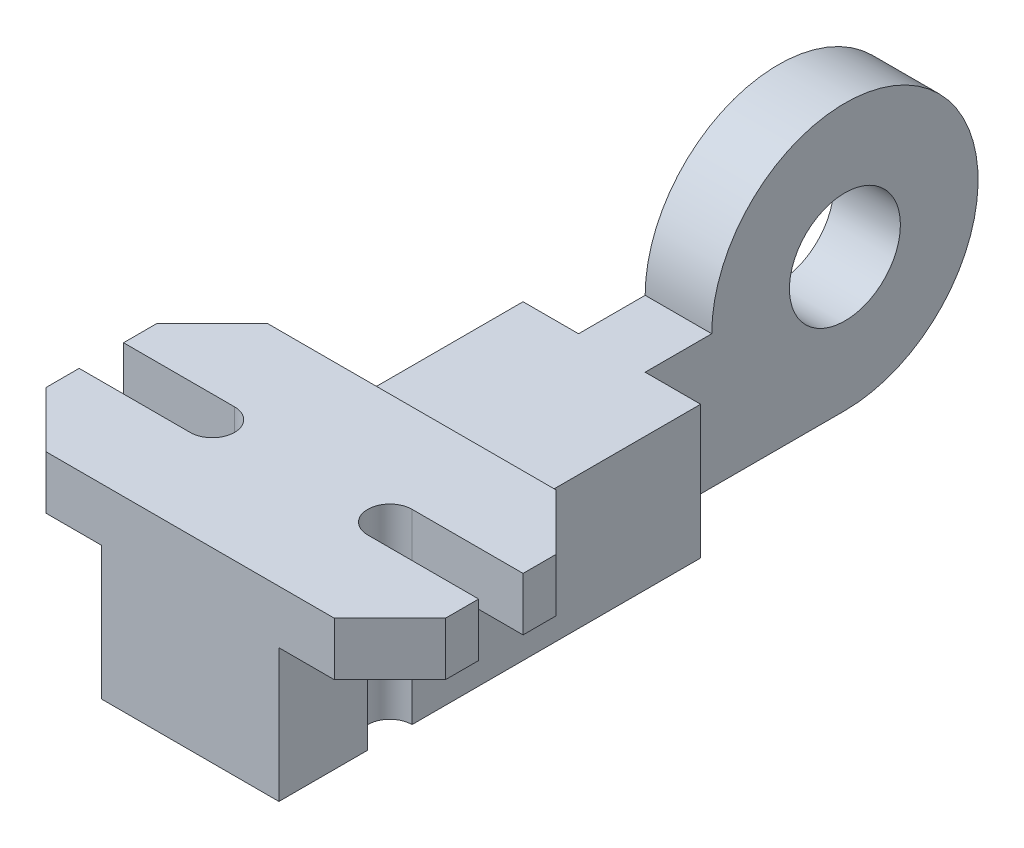
from build123d import *

# Parameters (mm, degrees)
SKETCH1_W           = 95
SKETCH1_H           = 30
BOSS_EXTRUDE1_DEPTH = 40
BOSS_EXTRUDE2_DEPTH = 12
SKETCH4_R           = 5
CUT_EXTRUDE1_DEPTH  = 87.62461911
SKETCH6_R           = 12.5
BOSS_EXTRUDE3_DEPTH = 7.5


with BuildPart() as part:
    # Sketch1 → Boss-Extrude1 (new body)
    with BuildSketch(Plane(origin=(0, 0, 0), x_dir=(0, 0, -1), z_dir=(1, 0, 0))):
        with Locations((1.273195876, 15)):
            Rectangle(SKETCH1_W, SKETCH1_H)
    extrude(amount=-BOSS_EXTRUDE1_DEPTH)

    # Sketch3 → Boss-Extrude2 (add)
    with BuildSketch(Plane(origin=(0, 30, 0), x_dir=(1, 0, 0), z_dir=(0, 1, 0))):
        with BuildLine():
            Line((12.468291965, 3.773195876), (0, 3.773195876))
            Line((0, 3.773195876), (-40, 3.741487841))
            Line((-40, 3.741487841), (-52.5, 3.741487841))
            Line((-52.5, 3.741487841), (-65, -8.758512159))
            Line((-65, -8.758512159), (-65, -16.226804124))
            Line((-65, -16.226804124), (-40, -16.226804124))
            ThreePointArc((-40, -16.226804124), (-35, -21.226804124), (-40, -26.226804124))
            Line((-40, -26.226804124), (-65, -26.226804124))
            Line((-65, -26.226804124), (-65, -33.695096088))
            Line((-65, -33.695096088), (-52.468291965, -46.226804124))
            Line((-52.468291965, -46.226804124), (12.468291965, -46.226804124))
            Line((12.468291965, -46.226804124), (25, -33.695096088))
            Line((25, -33.695096088), (25, -26.226804124))
            Line((25, -26.226804124), (0, -26.226804124))
            ThreePointArc((0, -26.226804124), (-5, -21.226804124), (0, -16.226804124))
            Line((0, -16.226804124), (25, -16.226804124))
            Line((25, -16.226804124), (25, -8.758512159))
            Line((25, -8.758512159), (12.468291965, 3.773195876))
        make_face()
    extrude(amount=BOSS_EXTRUDE2_DEPTH)

    # Sketch4 → Cut-Extrude1 (cut, through all)
    with BuildSketch(Plane(origin=(0, 30, 0), x_dir=(1, 0, 0), z_dir=(0, 1, 0))):
        with BuildLine():
            ThreePointArc((0, -16.226804124), (-5, -21.226804124), (0, -26.226804124))
            Line((0, -26.226804124), (0, -16.226804124))
        make_face()
        with Locations((-40, -21.226804124)):
            Circle(SKETCH4_R)
    extrude(amount=-CUT_EXTRUDE1_DEPTH, mode=Mode.SUBTRACT)


with BuildPart() as part_1:
    # Body-Move/Copy1: moved
    add(part.part.moved(Location((20, 0, 0))))

    # Sketch6 → Boss-Extrude3 (add, symmetric)
    with BuildSketch(Plane(origin=(0, 0, 0), x_dir=(0, 0, -1), z_dir=(1, 0, 0))):
        with BuildLine():
            Line((63.773195876, 30), (48.773195876, 30))
            Line((48.773195876, 30), (48.773195876, 0))
            Line((48.773195876, 0), (93.773195876, 0))
            ThreePointArc((93.773195876, 0), (114.986399312, 51.213203436), (63.773195876, 30))
        make_face()
        with Locations((93.773195876, 30)):
            Circle(SKETCH6_R, mode=Mode.SUBTRACT)
    extrude(amount=BOSS_EXTRUDE3_DEPTH, both=True)


solid = part_1.part
